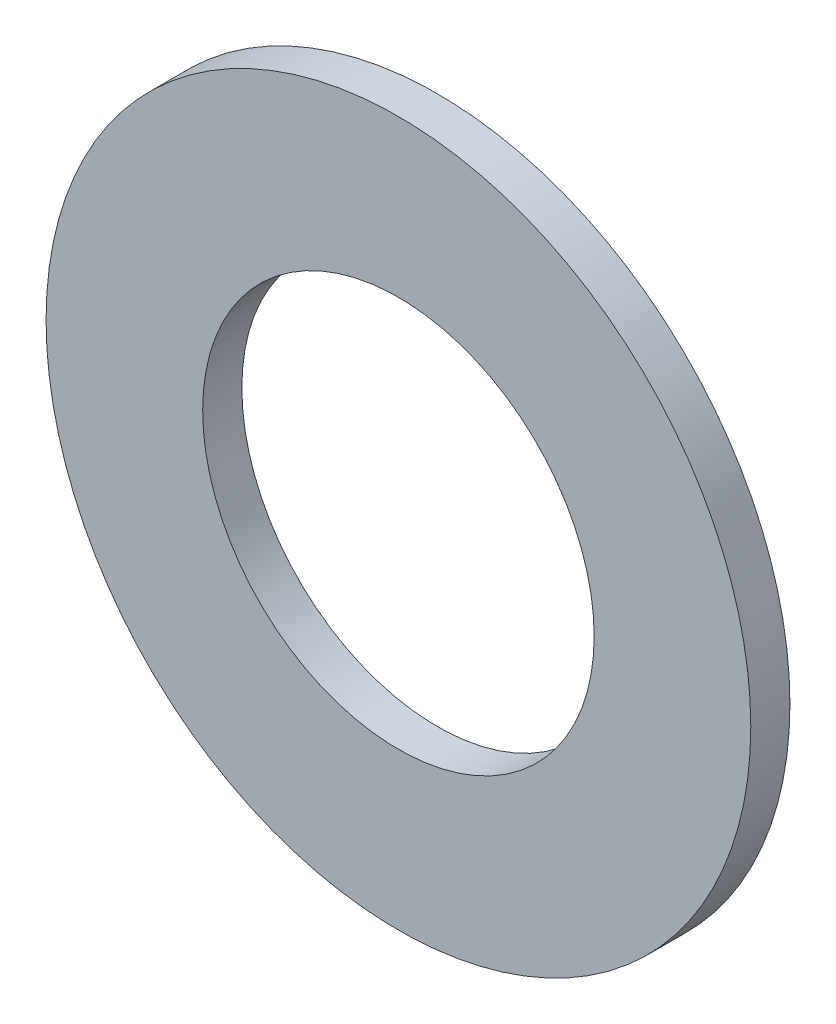
from build123d import *

# Parameters (mm, degrees)
SKETCH3_R               = 28.575
SKETCH3_R_2             = 15.875
BOSS_EXTRUDE1_DEPTH     = 76.2
CUT_EXTRUDE1_DEPTH      = 158.666804528
CUT_EXTRUDE1_DEPTH_BACK = 149.225
SKETCH4_R               = 34.894987184


with BuildPart() as part:
    # Sketch3 → Boss-Extrude1 (new, symmetric)
    with BuildSketch(Plane.XY):
        with Locations(Location((0, 0, 0), (0, 0, 180))):
            Circle(SKETCH3_R)
        with Locations(Location((0, 0, 0), (0, 0, 180))):
            Circle(SKETCH3_R_2, mode=Mode.SUBTRACT)
    extrude(amount=BOSS_EXTRUDE1_DEPTH, both=True)

    # Sketch4 → Cut-Extrude1 (cut, two sides: drawn at the far end of the back side and taken through both)
    with BuildSketch(Plane(origin=(0, 0, -76.2), x_dir=(-1, 0, 0), z_dir=(0, 0, -1)).offset(-CUT_EXTRUDE1_DEPTH_BACK)):
        Circle(SKETCH4_R)
    extrude(amount=CUT_EXTRUDE1_DEPTH + CUT_EXTRUDE1_DEPTH_BACK, mode=Mode.SUBTRACT)


solid = part.part
